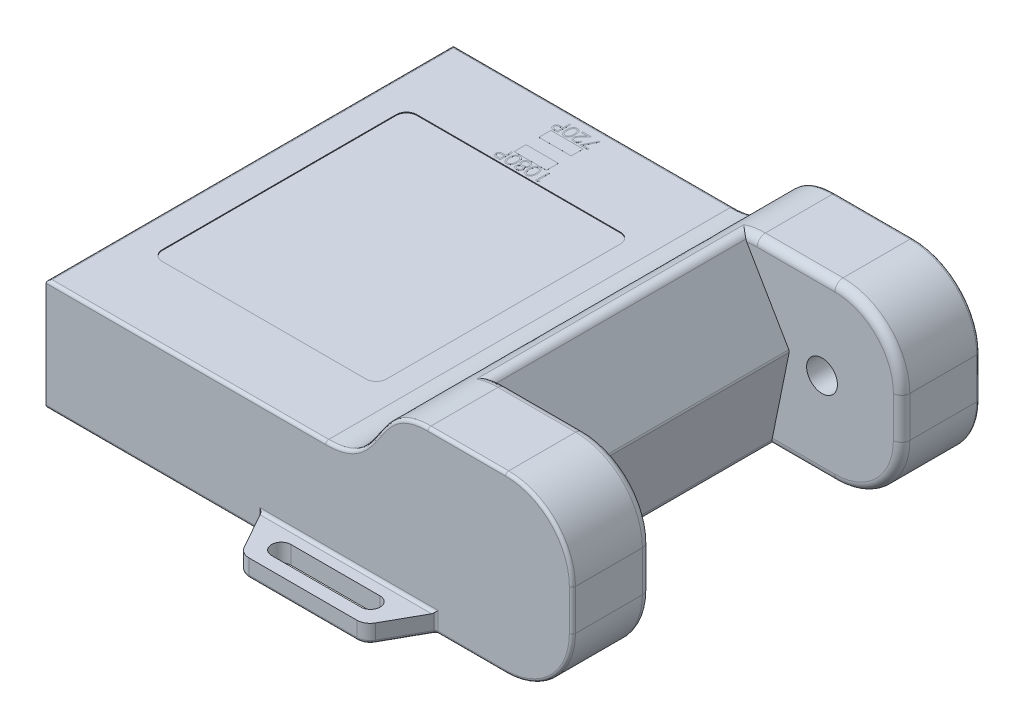
from build123d import *

# Parameters (mm, degrees)
SKETCH1_W               = 52.07
SKETCH1_H               = 40.2971
BOSS_EXTRUDE1_DEPTH     = 8.61568
CUT_EXTRUDE1_DEPTH      = 49.743280924
FILLET1_R               = 6.604
SKETCH3_W               = 11.43
SKETCH3_H               = 3.7338
CUT_EXTRUDE2_DEPTH      = 2.54
SKETCH4_W               = 3.059948917
SKETCH4_H               = 0.508
BOSS_EXTRUDE2_DEPTH     = 2.4892
SKETCH4_3_W             = 0.127
SKETCH4_3_H             = 0.508
BOSS_EXTRUDE3_DEPTH     = 1.0668
SKETCH6_R               = 0.127
BOSS_EXTRUDE4_DEPTH     = 1.524
FILLET2_R               = 0.254
FILLET3_R               = 0.127
SKETCH7_W               = 6.0452
SKETCH7_H               = 2.8702
BOSS_EXTRUDE5_DEPTH     = 0.8382
FILLET4_R               = 0.0508
SKETCH8_W               = 12.2174
SKETCH8_H               = 4.5466
BOSS_EXTRUDE6_DEPTH     = 1.778
FILLET5_R               = 1.3208
FILLET6_R               = 0.3048
CUT_EXTRUDE3_START      = -17.23136
SKETCH9_W               = 11.0998
SKETCH9_H               = 24.8285
CUT_EXTRUDE3_DEPTH      = 17.23136
CUT_EXTRUDE4_DEPTH      = 24.8285
FILLET7_R               = 0.8128
FILLET8_R               = 0.3048
FILLET9_R               = 0.3048
CUT_EXTRUDE5_DEPTH      = 14.95425
CUT_EXTRUDE5_DEPTH_BACK = 14.95425
SKETCH11_R              = 1.524
SKETCH12_W              = 3.2004
SKETCH12_H              = 1.1811
LEDS_DEPTH              = 0.00254
LEDS_2_DEPTH            = 0.00254
SKETCH13_W              = 22.1742
SKETCH13_H              = 25.1714
CUT_EXTRUDE6_DEPTH      = 0.0762
BOSS_EXTRUDE8_DEPTH     = 0.00254
FILLET10_R              = 1.016


with BuildPart() as part:
    # Sketch1 → Boss-Extrude1 (new, symmetric)
    with BuildSketch(Plane(origin=(0, 0, 0), x_dir=(1, 0, 0), z_dir=(0, 1, 0))):
        Rectangle(SKETCH1_W, SKETCH1_H)
    extrude(amount=BOSS_EXTRUDE1_DEPTH, both=True)

    # Sketch2 → Cut-Extrude1 (cut, through all)
    with BuildSketch(Plane.XY.offset(20.14855)):
        with BuildLine():
            Line((-26.035, 8.61568), (-26.035, 2.40792))
            Line((-26.035, 2.40792), (1.627580377, 2.40792))
            add(Edge.make_bspline(
                [(1.627580377, 2.40792), (7.588369881, 2.40792), (5.859828389, 8.61568), (11.7475, 8.61568)],
                knots=[0, 0, 0, 0, 1, 1, 1, 1], degree=3))
            Line((11.7475, 8.61568), (-26.035, 8.61568))
        make_face()
    extrude(amount=-CUT_EXTRUDE1_DEPTH, mode=Mode.SUBTRACT)

    # Fillet1
    fillet1_edges = [part.edges().sort_by_distance(p)[0] for p in [
        (26.035, 8.61568, 0),
        (26.035, -8.61568, 0),
    ]]
    fillet(fillet1_edges, radius=FILLET1_R)

    # Sketch3 → Cut-Extrude2 (cut)
    with BuildSketch(Plane.ZY.offset(26.035)):
        with Locations((12.73175, -1.66878)):
            Rectangle(SKETCH3_W, SKETCH3_H)
    extrude(amount=-CUT_EXTRUDE2_DEPTH, mode=Mode.SUBTRACT)

    # Sketch4 → Boss-Extrude2 (add)
    with BuildSketch(Plane.ZY.offset(23.495)):
        Polygon((17.93875, -0.05588), (7.52475, -0.05588), (7.52475, -3.28168), (9.544801083, -3.28168), (9.544801083, -2.77368), (8.03275, -2.77368), (8.03275, -0.56388), (17.43075, -0.56388), (17.43075, -2.77368), (15.918698917, -2.77368), (15.918698917, -3.28168), (17.93875, -3.28168), align=None)
        with Locations((11.201775542, -3.02768)):
            Rectangle(SKETCH4_W, SKETCH4_H)
        with Locations((14.261724459, -3.02768)):
            Rectangle(SKETCH4_W, SKETCH4_H)
    extrude(amount=BOSS_EXTRUDE2_DEPTH)

    # Sketch4<3> → Boss-Extrude3 (add)
    with BuildSketch(Plane.ZY.offset(23.495)):
        with Locations((15.855198917, -3.02768)):
            Rectangle(SKETCH4_3_W, SKETCH4_3_H)
        with Locations((9.608301083, -3.02768)):
            Rectangle(SKETCH4_3_W, SKETCH4_3_H)
    extrude(amount=BOSS_EXTRUDE3_DEPTH)

    # Sketch6 → Boss-Extrude4 (add)
    with BuildSketch(Plane.ZY.offset(23.495)):
        with Locations(Location((8.873947615, -1.960843183, 0), (0, 0, 180))):
            Circle(SKETCH6_R)
        with Locations(Location((10.143947615, -1.960843183, 0), (0, 0, 180))):
            Circle(SKETCH6_R)
        with Locations(Location((11.413947615, -1.960843183, 0), (0, 0, 180))):
            Circle(SKETCH6_R)
        with Locations(Location((12.683947615, -1.960843183, 0), (0, 0, 180))):
            Circle(SKETCH6_R)
        with Locations(Location((13.953947615, -1.960843183, 0), (0, 0, 180))):
            Circle(SKETCH6_R)
        with Locations(Location((15.223947615, -1.960843183, 0), (0, 0, 180))):
            Circle(SKETCH6_R)
        with Locations(Location((16.493947615, -1.960843183, 0), (0, 0, 180))):
            Circle(SKETCH6_R)
    extrude(amount=BOSS_EXTRUDE4_DEPTH)

    # Fillet2
    fillet2_edges = [part.edges().sort_by_distance(p)[0] for p in [
        (-24.7396, -3.28168, 7.52475),
        (-24.7396, -0.05588, 7.52475),
        (-24.7396, -0.05588, 17.93875),
        (-24.7396, -3.28168, 17.93875),
    ]]
    fillet(fillet2_edges, radius=FILLET2_R)

    # Fillet3
    fillet3_edges = [part.edges().sort_by_distance(p)[0] for p in [
        (-24.765, -3.53568, 7.01675),
        (-24.765, 0.19812, 7.01675),
        (-24.765, 0.19812, 18.44675),
        (-24.765, -3.53568, 18.44675),
    ]]
    fillet(fillet3_edges, radius=FILLET3_R)

    # Sketch8 → Boss-Extrude6 (add)
    # profile 1 of 3: a face of its own
    with BuildSketch(Plane.XZ.offset(8.61568)):
        Polygon((-2.1844, 20.14855), (-2.1844, 24.69515), (-4.7244, 20.14855), align=None)
    # profile 2 of 3: a face of its own
    with BuildSketch(Plane.XZ.offset(8.61568)):
        with Locations((3.9243, 22.42185)):
            Rectangle(SKETCH8_W, SKETCH8_H)
        with BuildLine():
            ThreePointArc((-0.48895, 21.46935), (-1.44145, 22.42185), (-0.48895, 23.37435))
            Line((-0.48895, 23.37435), (8.33755, 23.37435))
            ThreePointArc((8.33755, 23.37435), (9.29005, 22.42185), (8.33755, 21.46935))
            Line((8.33755, 21.46935), (-0.48895, 21.46935))
        make_face(mode=Mode.SUBTRACT)
    # profile 3 of 3: a face of its own
    with BuildSketch(Plane.XZ.offset(8.61568)):
        Polygon((12.573, 20.14855), (10.033, 24.69515), (10.033, 20.14855), align=None)
    boss_extrude6 = extrude(amount=-BOSS_EXTRUDE6_DEPTH)

    # Mirror1: Boss-Extrude6 across plane
    add(boss_extrude6.mirror(Plane.XY))

    # Fillet5
    fillet5_edges = [part.edges().sort_by_distance(p)[0] for p in [
        (-2.1844, -7.72668, 24.69515),
        (10.033, -7.72668, 24.69515),
        (10.033, -7.72668, -24.69515),
        (-2.1844, -7.72668, -24.69515),
    ]]
    fillet(fillet5_edges, radius=FILLET5_R)

    # Fillet6
    fillet6_edges = [part.edges().sort_by_distance(p)[0] for p in [
        (12.573, -7.72668, 20.14855),
        (-4.7244, -7.72668, 20.14855),
        (3.9243, -6.83768, 20.14855),
        (3.9243, -6.83768, -20.14855),
        (-4.7244, -7.72668, -20.14855),
        (12.573, -7.72668, -20.14855),
    ]]
    fillet(fillet6_edges, radius=FILLET6_R)

    # Sketch9 → Cut-Extrude3 (cut)
    with BuildSketch(Plane(origin=(0, 8.61568, 0), x_dir=(1, 0, 0), z_dir=(0, 1, 0)).offset(CUT_EXTRUDE3_START)):
        with Locations((20.4851, 0)):
            Rectangle(SKETCH9_W, SKETCH9_H)
    extrude(amount=CUT_EXTRUDE3_DEPTH, mode=Mode.SUBTRACT)

    # Sketch10 → Cut-Extrude4 (cut)
    with BuildSketch(Plane.XY.offset(-12.41425)):
        Polygon((10.287, 8.463876967), (14.9352, 0.48768), (14.9352, 8.463876967), (14.9352, 8.61568), (14.9352, 11.529790854), (10.287, 11.529790854), align=None)
        Polygon((14.9352, -8.61568), (14.9352, 0.48768), (13.081, -8.61568), (13.081, -10.46973801), (14.9352, -10.46973801), align=None)
    extrude(amount=CUT_EXTRUDE4_DEPTH, mode=Mode.SUBTRACT)

    # Fillet7
    fillet7_edges = [part.edges().sort_by_distance(p)[0] for p in [
        (26.035, 0, -12.41425),
        (16.256, -8.61568, 12.41425),
        (24.100733183, -6.681413183, 12.41425),
        (26.035, 0, 12.41425),
        (24.100733183, 6.681413183, 12.41425),
        (24.100733183, -6.681413183, -12.41425),
        (16.256, -8.61568, -12.41425),
        (24.100733183, 6.681413183, -12.41425),
        (15.58925, 8.61568, 12.41425),
        (15.58925, 8.61568, -12.41425),
        (11.01291256, 8.580648489, -12.41425),
        (11.01291256, 8.580648489, 12.41425),
        (10.287, 8.463876967, 0),
        (13.081, -8.61568, 0),
    ]]
    fillet(fillet7_edges, radius=FILLET7_R)

    # Fillet8
    fillet8_edges = [part.edges().sort_by_distance(p)[0] for p in [
        (14.9352, 0.48768, 0),
    ]]
    fillet(fillet8_edges, radius=FILLET8_R)

    # Fillet9
    fillet9_edges = [part.edges().sort_by_distance(p)[0] for p in [
        (15.58925, 8.61568, 20.14855),
        (-12.203709812, 2.40792, -20.14855),
        (-12.203709812, 2.40792, 20.14855),
        (6.701452199, 5.49181642, -20.14855),
        (6.701464032, 5.491833932, 20.14855),
        (-26.035, 2.40792, 0),
        (26.035, 0, -20.14855),
        (26.035, 0, 20.14855),
        (15.58925, 8.61568, -20.14855),
        (3.9243, -8.61568, -24.69515),
        (11.448386749, -8.61568, 22.161607719),
        (3.9243, -8.61568, 24.69515),
        (-15.46912987, -8.61568, -20.14855),
        (-3.599786749, -8.61568, 22.161607719),
        (-3.599786749, -8.61568, -22.161607719),
        (11.448386749, -8.61568, -22.161607719),
        (9.926406837, -8.61568, 24.513501541),
        (24.100733183, 6.681413183, -20.14855),
        (-2.077806837, -8.61568, 24.513501541),
        (-2.077806837, -8.61568, -24.513501541),
        (9.926406837, -8.61568, -24.513501541),
        (24.100733183, -6.681413183, -20.14855),
        (24.100733183, 6.681413183, 20.14855),
        (24.100733183, -6.681413183, 20.14855),
        (-15.46912987, -8.61568, 20.14855),
        (12.597598422, -8.61568, -20.190468875),
        (-4.748998422, -8.61568, -20.190468875),
        (12.597598422, -8.61568, 20.190468875),
        (-4.748998422, -8.61568, 20.190468875),
        (-26.035, -8.61568, 0),
    ]]
    fillet(fillet9_edges, radius=FILLET9_R)

    # Sketch11 → Cut-Extrude5 (cut, two sides: drawn at the far end of the back side and taken through both)
    with BuildSketch(Plane.XY.offset(-CUT_EXTRUDE5_DEPTH_BACK)):
        with Locations((18.161, 0)):
            Circle(SKETCH11_R)
    extrude(amount=CUT_EXTRUDE5_DEPTH + CUT_EXTRUDE5_DEPTH_BACK, mode=Mode.SUBTRACT)

    # Sketch13 → Cut-Extrude6 (cut)
    with BuildSketch(Plane(origin=(0, 2.40792, 0), x_dir=(1, 0, 0), z_dir=(0, 1, 0))):
        with Locations((-11.7729, -0.24765)):
            Rectangle(SKETCH13_W, SKETCH13_H)
    extrude(amount=-CUT_EXTRUDE6_DEPTH, mode=Mode.SUBTRACT)

    # Sketch14 → Boss-Extrude8 (add)
    # profile 1 of 9: a face of its own
    with BuildSketch(Plane(origin=(0, 2.40792, 0), x_dir=(1, 0, 0), z_dir=(0, 1, 0))):
        with BuildLine():
            Line((-13.851141026, 12.57935), (-14.100205529, 12.57935))
            add(Edge.make_bspline(
                [(-14.100205529, 12.57935), (-14.117336343, 12.579368831), (-14.150159745, 12.579404912), (-14.197227779, 12.580498834), (-14.239975882, 12.581959948), (-14.278311877, 12.583985378), (-14.312353719, 12.586378998), (-14.341947367, 12.589736166), (-14.367325435, 12.593241473), (-14.382531489, 12.596805241), (-14.389466346, 12.598430529)],
                knots=[0, 0, 0, 0, 1.415646017, 2.712440637, 3.8905458, 4.950247383, 5.884950622, 6.709939814, 7.411656543, 8, 8, 8, 8], degree=3))
            add(Edge.make_bspline(
                [(-14.389466346, 12.598430529), (-14.398245087, 12.600833423), (-14.415595708, 12.605582591), (-14.440597751, 12.615093378), (-14.464381436, 12.626375658), (-14.487046249, 12.639215092), (-14.508203916, 12.654218018), (-14.528515019, 12.670518518), (-14.547553606, 12.688775824), (-14.565032199, 12.708965897), (-14.581226871, 12.73042732), (-14.594782972, 12.753707347), (-14.606753543, 12.777998384), (-14.616082317, 12.803893504), (-14.623415093, 12.831050895), (-14.628755561, 12.85954124), (-14.632187994, 12.889303078), (-14.632513689, 12.909645501), (-14.632679487, 12.920001042)],
                knots=[0, 0, 0, 0, 0.999333726, 1.975119402, 2.933498163, 3.889020618, 4.832249799, 5.779334906, 6.747801194, 7.724875447, 8.710438469, 9.696133548, 10.679360639, 11.681339199, 12.714023775, 13.766351759, 14.862936069, 16, 16, 16, 16], degree=3))
            add(Edge.make_bspline(
                [(-14.632679487, 12.920001042), (-14.63252657, 12.930443264), (-14.632227378, 12.950874176), (-14.62863644, 12.98076373), (-14.623799485, 13.009327261), (-14.616361983, 13.036501433), (-14.606620839, 13.062124869), (-14.595193722, 13.086589145), (-14.581411127, 13.109478054), (-14.565574289, 13.130874694), (-14.547956996, 13.150799148), (-14.528633787, 13.169107031), (-14.507682672, 13.185691176), (-14.485170236, 13.200588764), (-14.460877005, 13.213454328), (-14.435171423, 13.224977693), (-14.407830059, 13.234655478), (-14.388909776, 13.239746386), (-14.379290064, 13.242334776)],
                knots=[0, 0, 0, 0, 1.121902311, 2.195077645, 3.232258892, 4.234102512, 5.217864754, 6.176164875, 7.132989551, 8.084763148, 9.034132444, 9.988522005, 10.94243251, 11.903244335, 12.886203696, 13.894208494, 14.929344452, 16, 16, 16, 16], degree=3))
            add(Edge.make_bspline(
                [(-14.379290064, 13.242334776), (-14.371333484, 13.244025511), (-14.353896175, 13.247730855), (-14.325180474, 13.251895558), (-14.291729899, 13.255311069), (-14.253658266, 13.258498452), (-14.210876791, 13.260187366), (-14.163483594, 13.262170427), (-14.111318282, 13.263106125), (-14.074934603, 13.263165273), (-14.055938702, 13.263196154)],
                knots=[0, 0, 0, 0, 0.601372724, 1.317943291, 2.144091499, 3.08771165, 4.142394186, 5.309582461, 6.595334295, 8, 8, 8, 8], degree=3))
            Line((-14.055938702, 13.263196154), (-13.965115385, 13.263196154))
            Line((-13.965115385, 13.263196154), (-13.965115385, 13.84935))
            Line((-13.965115385, 13.84935), (-13.851141026, 13.84935))
            Line((-13.851141026, 13.84935), (-13.851141026, 12.57935))
        make_face()
        with BuildLine():
            Line((-13.965115385, 12.70960641), (-13.965115385, 13.132939744))
            Line((-13.965115385, 13.132939744), (-14.187467147, 13.135738221))
            add(Edge.make_bspline(
                [(-14.187467147, 13.135738221), (-14.198323989, 13.13574538), (-14.219282898, 13.1357592), (-14.249640433, 13.134288336), (-14.277737416, 13.132688202), (-14.303615331, 13.130100406), (-14.327156064, 13.126944102), (-14.348416611, 13.122724107), (-14.36756664, 13.118419985), (-14.389625353, 13.110951569), (-14.414333425, 13.099684516), (-14.441150433, 13.082855767), (-14.464063367, 13.061655776), (-14.483723765, 13.037561765), (-14.499263967, 13.010729959), (-14.510526625, 12.982101197), (-14.517401117, 12.951784187), (-14.518265183, 12.931061146), (-14.518705128, 12.920509856)],
                knots=[0, 0, 0, 0, 1.160501667, 2.240324542, 3.248665471, 4.168823117, 5.020172044, 5.786515869, 6.485785279, 7.116517804, 8.272762037, 9.381837012, 10.485674779, 11.594342068, 12.695271952, 13.786226926, 14.872841088, 16, 16, 16, 16], degree=3))
            add(Edge.make_bspline(
                [(-14.518705128, 12.920509856), (-14.518245555, 12.910300399), (-14.517331981, 12.890005261), (-14.510583411, 12.860246829), (-14.499144692, 12.831943531), (-14.483711096, 12.805324392), (-14.46452183, 12.78129442), (-14.442064587, 12.760566899), (-14.416688766, 12.743790397), (-14.393267938, 12.73262244), (-14.372308141, 12.726073301), (-14.354190303, 12.721345154), (-14.333629329, 12.718084252), (-14.310819801, 12.714964182), (-14.285790924, 12.712445607), (-14.258383546, 12.710696627), (-14.228688957, 12.709683778), (-14.208074932, 12.709632824), (-14.197389022, 12.70960641)],
                knots=[0, 0, 0, 0, 1.12039168, 2.227199994, 3.330242575, 4.460839274, 5.593542475, 6.693949254, 7.801736126, 8.92216649, 9.528704869, 10.210659466, 10.975987387, 11.81211542, 12.738540127, 13.736887663, 14.826846554, 16, 16, 16, 16], degree=3))
            Line((-14.197389022, 12.70960641), (-13.965115385, 12.70960641))
        make_face(mode=Mode.SUBTRACT)
    # profile 2 of 9: a face of its own
    with BuildSketch(Plane(origin=(0, 2.40792, 0), x_dir=(1, 0, 0), z_dir=(0, 1, 0))):
        with BuildLine():
            add(Edge.make_bspline(
                [(-12.76024359, 13.214858814), (-12.760362613, 13.194503476), (-12.760593819, 13.154962939), (-12.763165903, 13.097346798), (-12.76743867, 13.043295492), (-12.773294232, 12.992806438), (-12.780420009, 12.945866594), (-12.789932499, 12.902601423), (-12.800750243, 12.86281061), (-12.813287994, 12.826364636), (-12.827434479, 12.792771669), (-12.842833862, 12.761413382), (-12.860086675, 12.732327232), (-12.878244078, 12.705084673), (-12.897941546, 12.679959863), (-12.91911058, 12.65706572), (-12.941564723, 12.636047464), (-12.965410221, 12.617250713), (-12.990419797, 12.600871852), (-13.015853634, 12.586024785), (-13.042437158, 12.574280345), (-13.069514672, 12.564237496), (-13.097304333, 12.556282203), (-13.125818247, 12.550748672), (-13.155082002, 12.547286778), (-13.174832501, 12.546954442), (-13.184848958, 12.546785897)],
                knots=[0, 0, 0, 0, 1.64625301, 3.197870201, 4.6634513, 6.030635694, 7.308242971, 8.501545196, 9.611429483, 10.641742253, 11.616230371, 12.55791849, 13.464870342, 14.34944951, 15.20427819, 16.044004467, 16.869007726, 17.689551165, 18.496129964, 19.285613293, 20.0683943, 20.843080271, 21.620342827, 22.403213977, 23.190190624, 24, 24, 24, 24], degree=3))
            add(Edge.make_bspline(
                [(-13.184848958, 12.546785897), (-13.194954159, 12.546926051), (-13.215059951, 12.547204907), (-13.244678219, 12.551129976), (-13.273780588, 12.556196176), (-13.301925516, 12.564321526), (-13.329645171, 12.574044562), (-13.356250219, 12.586873953), (-13.382679961, 12.600826911), (-13.407733729, 12.617848348), (-13.432160082, 12.636659835), (-13.455057238, 12.658015684), (-13.477010509, 12.681324866), (-13.497190729, 12.707107246), (-13.516462793, 12.734967504), (-13.534095116, 12.765139188), (-13.550454416, 12.797555434), (-13.565848206, 12.832065964), (-13.579309668, 12.869592609), (-13.591277985, 12.909901306), (-13.601088045, 12.953357068), (-13.609200792, 12.99971782), (-13.615497829, 13.049213232), (-13.620080705, 13.10174302), (-13.622502357, 13.157340049), (-13.622958321, 13.195352195), (-13.623192308, 13.214858814)],
                knots=[0, 0, 0, 0, 0.810910589, 1.61342667, 2.396193133, 3.181089899, 3.963115317, 4.752255436, 5.550715454, 6.36105385, 7.181178335, 8.024612154, 8.872680183, 9.750181803, 10.651284446, 11.591556747, 12.554036451, 13.566402641, 14.62422919, 15.753422176, 16.94128843, 18.199818041, 19.531985927, 20.947085226, 22.433341622, 24, 24, 24, 24], degree=3))
            add(Edge.make_bspline(
                [(-13.623192308, 13.214858814), (-13.622952882, 13.234280104), (-13.622485327, 13.272206402), (-13.620135819, 13.32755688), (-13.615374977, 13.379800027), (-13.609572372, 13.429011533), (-13.60120615, 13.475127072), (-13.591892046, 13.5183943), (-13.580011382, 13.558406671), (-13.566869223, 13.595611647), (-13.551689627, 13.629975988), (-13.535453532, 13.66225843), (-13.517557999, 13.692258883), (-13.49865573, 13.720295733), (-13.478093458, 13.745856997), (-13.456437281, 13.769426921), (-13.433317987, 13.790819872), (-13.408765893, 13.809853473), (-13.383475322, 13.82700313), (-13.357040428, 13.841453609), (-13.330080026, 13.854051478), (-13.302313694, 13.864178691), (-13.273918488, 13.872184293), (-13.244792155, 13.877634065), (-13.21505599, 13.881475468), (-13.194952834, 13.881767385), (-13.184848958, 13.881914103)],
                knots=[0, 0, 0, 0, 1.561431216, 3.049195289, 4.452146966, 5.778046447, 7.031138842, 8.218704273, 9.334037798, 10.384210803, 11.388620812, 12.352076869, 13.287433199, 14.19507451, 15.06813243, 15.922055533, 16.766344942, 17.596869952, 18.417486629, 19.220035357, 20.016159057, 20.807716045, 21.59340902, 22.384936649, 23.188266813, 24, 24, 24, 24], degree=3))
            add(Edge.make_bspline(
                [(-13.184848958, 13.881914103), (-13.17483285, 13.881744065), (-13.155083039, 13.881408783), (-13.125814242, 13.877968464), (-13.097341672, 13.872358463), (-13.069608407, 13.86474011), (-13.042557699, 13.855057631), (-13.016454509, 13.842741892), (-12.990954203, 13.828457495), (-12.966172765, 13.812206527), (-12.942583941, 13.793582552), (-12.920047116, 13.772987974), (-12.899152175, 13.74989205), (-12.879590548, 13.724663408), (-12.861282488, 13.697352269), (-12.844102736, 13.66804345), (-12.828750249, 13.636379679), (-12.814283009, 13.60260435), (-12.801530027, 13.565890581), (-12.790394358, 13.52596341), (-12.781005976, 13.482550497), (-12.773527999, 13.435649764), (-12.767401868, 13.385333817), (-12.763170115, 13.331522473), (-12.760595105, 13.274330993), (-12.7603629, 13.235044629), (-12.76024359, 13.214858814)],
                knots=[0, 0, 0, 0, 0.810976328, 1.599087026, 2.383086309, 3.159618043, 3.926613167, 4.707144544, 5.494386734, 6.292609454, 7.104690378, 7.92621526, 8.762510248, 9.62398222, 10.509836085, 11.424023232, 12.373226806, 13.358118208, 14.398657954, 15.5185989, 16.713620699, 17.994156382, 19.364120462, 20.818119981, 22.365111093, 24, 24, 24, 24], degree=3))
        make_face()
        with BuildLine():
            add(Edge.make_bspline(
                [(-12.874217949, 13.21435), (-12.874262241, 13.231313031), (-12.874348205, 13.264234945), (-12.876528943, 13.311991598), (-12.879564307, 13.356609069), (-12.883382971, 13.398069942), (-12.88910196, 13.436229318), (-12.895590517, 13.471245822), (-12.903373094, 13.503054696), (-12.912626851, 13.531933725), (-12.923167225, 13.558292477), (-12.934657166, 13.582831329), (-12.947103256, 13.605848759), (-12.960791045, 13.627261721), (-12.97591664, 13.646950619), (-12.992142432, 13.66500896), (-13.009562768, 13.681363218), (-13.03367248, 13.700772408), (-13.065346955, 13.721065415), (-13.105459511, 13.73851933), (-13.146695138, 13.749558899), (-13.174691308, 13.750958906), (-13.188665064, 13.751657692)],
                knots=[0, 0, 0, 0, 1.459193451, 2.832007961, 4.111736495, 5.306635028, 6.412683014, 7.430020708, 8.369596877, 9.227877302, 10.036669781, 10.810175692, 11.557788084, 12.286326232, 12.994037279, 13.69140682, 14.37267704, 15.047194847, 16.352618509, 17.594157723, 18.799169539, 20, 20, 20, 20], degree=3))
            add(Edge.make_bspline(
                [(-13.188665064, 13.751657692), (-13.20271906, 13.751044952), (-13.230777199, 13.749821645), (-13.271984759, 13.739145106), (-13.311658284, 13.721788444), (-13.34296821, 13.701958868), (-13.366722144, 13.682953611), (-13.383747726, 13.666768484), (-13.399372704, 13.648640636), (-13.414192652, 13.629083171), (-13.427784915, 13.607720791), (-13.440144976, 13.584656679), (-13.451423788, 13.559826657), (-13.457849643, 13.542493067), (-13.461135016, 13.533630849)],
                knots=[0, 0, 0, 0, 1.353621445, 2.702441307, 4.075953605, 5.516772412, 6.261413105, 7.007624062, 7.778524365, 8.566925914, 9.372323995, 10.217594641, 11.088702136, 12, 12, 12, 12], degree=3))
            add(Edge.make_bspline(
                [(-13.461135016, 13.533630849), (-13.4649638, 13.522298915), (-13.472737875, 13.499290229), (-13.482757004, 13.463598276), (-13.490647477, 13.426150416), (-13.497746184, 13.387170445), (-13.502591436, 13.346370896), (-13.506491357, 13.303878008), (-13.508788492, 13.259659742), (-13.509073244, 13.229616989), (-13.509217949, 13.21435)],
                knots=[0, 0, 0, 0, 0.884706709, 1.796334032, 2.740027952, 3.714592787, 4.726048262, 5.777819803, 6.87074269, 8, 8, 8, 8], degree=3))
            add(Edge.make_bspline(
                [(-13.509217949, 13.21435), (-13.509058355, 13.19908334), (-13.508746118, 13.169214794), (-13.506694692, 13.125517085), (-13.503398219, 13.083941152), (-13.498936516, 13.04444928), (-13.492811543, 13.007111758), (-13.485456055, 12.971875161), (-13.476832603, 12.938748972), (-13.466941201, 12.907647821), (-13.455793887, 12.878683287), (-13.443478898, 12.851793021), (-13.430339033, 12.826831991), (-13.41605784, 12.803880481), (-13.400837372, 12.782804569), (-13.384131117, 12.764089409), (-13.367000243, 12.746824561), (-13.342636514, 12.727469394), (-13.310999476, 12.707578764), (-13.271360759, 12.689772135), (-13.230336396, 12.679233691), (-13.202545493, 12.677772242), (-13.188665064, 12.677042308)],
                knots=[0, 0, 0, 0, 1.313528337, 2.569860077, 3.762944266, 4.901481389, 5.988248151, 7.017139294, 7.997571128, 8.932104357, 9.823695246, 10.66607014, 11.475539426, 12.248954257, 12.990316782, 13.708962568, 14.405488541, 15.08007697, 16.381737273, 17.610043218, 18.806313575, 20, 20, 20, 20], degree=3))
            add(Edge.make_bspline(
                [(-13.188665064, 12.677042308), (-13.174615925, 12.677773106), (-13.146492052, 12.679236033), (-13.105038528, 12.689734953), (-13.065162516, 12.707452118), (-13.033592147, 12.72749399), (-13.00957141, 12.746749394), (-12.992477825, 12.763183473), (-12.976345941, 12.781072932), (-12.961292807, 12.800672559), (-12.947688531, 12.822044691), (-12.93509117, 12.844895258), (-12.923692898, 12.869397658), (-12.913112739, 12.895741841), (-12.90395717, 12.924668324), (-12.895725245, 12.956470854), (-12.889371438, 12.991715086), (-12.883729816, 13.030053659), (-12.879465391, 13.071563826), (-12.876550097, 13.116286917), (-12.874341581, 13.164210047), (-12.874259985, 13.197301937), (-12.874217949, 13.21435)],
                knots=[0, 0, 0, 0, 1.207779899, 2.417760083, 3.652287919, 4.947299644, 5.621638849, 6.297435916, 6.984320042, 7.691843698, 8.42018894, 9.161205785, 9.934506883, 10.743085206, 11.601138371, 12.542248028, 13.566483018, 14.679455109, 15.87477181, 17.154161492, 18.533899613, 20, 20, 20, 20], degree=3))
        make_face(mode=Mode.SUBTRACT)
    # profile 3 of 9: a face of its own
    with BuildSketch(Plane(origin=(0, 2.40792, 0), x_dir=(1, 0, 0), z_dir=(0, 1, 0))):
        with BuildLine():
            add(Edge.make_bspline(
                [(-12.400766426, 13.14184399), (-12.411079011, 13.147263354), (-12.431254909, 13.157865986), (-12.459996239, 13.174989566), (-12.486821709, 13.192412211), (-12.511235164, 13.210760334), (-12.533475955, 13.229643918), (-12.553612524, 13.249012995), (-12.571861428, 13.268806309), (-12.587595737, 13.289532709), (-12.601556115, 13.310823619), (-12.613382268, 13.332941443), (-12.623703497, 13.355566575), (-12.631804375, 13.379042512), (-12.638492578, 13.403047196), (-12.643091003, 13.427902731), (-12.645564842, 13.453442043), (-12.64603246, 13.470702561), (-12.646269231, 13.479442147)],
                knots=[0, 0, 0, 0, 1.264219729, 2.473363326, 3.62979159, 4.734286947, 5.785533755, 6.79450939, 7.765315851, 8.704182021, 9.615576613, 10.525715488, 11.423813905, 12.311666436, 13.218214638, 14.126256791, 15.051260205, 16, 16, 16, 16], degree=3))
            add(Edge.make_bspline(
                [(-12.646269231, 13.479442147), (-12.645990884, 13.491670137), (-12.645439932, 13.515873917), (-12.640591128, 13.551588132), (-12.633428803, 13.586414341), (-12.622548545, 13.619957748), (-12.60915987, 13.652504152), (-12.592265133, 13.683615062), (-12.573197236, 13.714183532), (-12.557862638, 13.732985356), (-12.550103365, 13.742499038)],
                knots=[0, 0, 0, 0, 1.02531512, 2.029483338, 3.018748588, 4.004195107, 4.983200899, 5.966616707, 6.971112471, 8, 8, 8, 8], degree=3))
            add(Edge.make_bspline(
                [(-12.550103365, 13.742499038), (-12.540002702, 13.753600208), (-12.519926191, 13.775665367), (-12.485533529, 13.804313232), (-12.447788446, 13.828388584), (-12.406836993, 13.848008957), (-12.36278864, 13.863280111), (-12.315652769, 13.874253825), (-12.265337491, 13.880539392), (-12.23075522, 13.881447983), (-12.213014022, 13.881914103)],
                knots=[0, 0, 0, 0, 0.954267603, 1.896743057, 2.838368354, 3.796610408, 4.779680527, 5.799409237, 6.871065594, 8, 8, 8, 8], degree=3))
            add(Edge.make_bspline(
                [(-12.213014022, 13.881914103), (-12.195955271, 13.881494795), (-12.162760675, 13.880678866), (-12.114437979, 13.875180909), (-12.06933895, 13.865447422), (-12.027249764, 13.852400635), (-11.98857741, 13.835002435), (-11.953251575, 13.813677321), (-11.920754492, 13.788906743), (-11.892105638, 13.760094571), (-11.8666782, 13.729227944), (-11.844322492, 13.697393635), (-11.825845571, 13.664614811), (-11.809919948, 13.631390075), (-11.798068195, 13.597046221), (-11.789662148, 13.561935696), (-11.784381978, 13.526158246), (-11.783675782, 13.502017451), (-11.783320513, 13.489872837)],
                knots=[0, 0, 0, 0, 1.256864279, 2.445730223, 3.576845088, 4.651810441, 5.686528262, 6.692706664, 7.686234615, 8.689148594, 9.678739427, 10.630299996, 11.55097961, 12.448208961, 13.341360817, 14.221834469, 15.105450545, 16, 16, 16, 16], degree=3))
            add(Edge.make_bspline(
                [(-11.783320513, 13.489872837), (-11.783530252, 13.480961378), (-11.783944772, 13.463349192), (-11.78681236, 13.43732866), (-11.791426467, 13.412003708), (-11.797679007, 13.387274377), (-11.806230447, 13.363271151), (-11.816375505, 13.339870241), (-11.828318673, 13.317072326), (-11.842530241, 13.295224497), (-11.858187704, 13.273552853), (-11.876774554, 13.253133489), (-11.897051614, 13.232767001), (-11.920225987, 13.213691873), (-11.945046084, 13.194332232), (-11.972669457, 13.176306201), (-12.00217503, 13.158206936), (-12.023151139, 13.14739189), (-12.033911458, 13.14184399)],
                knots=[0, 0, 0, 0, 0.941575622, 1.860885767, 2.762557628, 3.660168386, 4.552890429, 5.45184204, 6.353736508, 7.268493418, 8.204037487, 9.175167802, 10.182660057, 11.238220596, 12.344046335, 13.507168087, 14.721227736, 16, 16, 16, 16], degree=3))
            add(Edge.make_bspline(
                [(-12.033911458, 13.14184399), (-12.019200519, 13.133788902), (-11.990760566, 13.118216386), (-11.952743231, 13.089962242), (-11.920539334, 13.058806789), (-11.894491115, 13.024703144), (-11.873924728, 12.988772174), (-11.859384057, 12.951203036), (-11.84989303, 12.912414752), (-11.84893158, 12.885964993), (-11.848448718, 12.87268133)],
                knots=[0, 0, 0, 0, 1.16701039, 2.256125286, 3.287752239, 4.277689688, 5.235169525, 6.160862735, 7.076343936, 8, 8, 8, 8], degree=3))
            add(Edge.make_bspline(
                [(-11.848448718, 12.87268133), (-11.849043196, 12.859148269), (-11.8502382, 12.831944457), (-11.859867941, 12.791437762), (-11.875679467, 12.751631892), (-11.896817123, 12.712619092), (-11.923717404, 12.676177021), (-11.955557645, 12.643228142), (-11.992297794, 12.614625208), (-12.033130316, 12.590446327), (-12.076993311, 12.570673335), (-12.123350735, 12.55717461), (-12.171376385, 12.548296487), (-12.204069597, 12.547294129), (-12.220646234, 12.546785897)],
                knots=[0, 0, 0, 0, 0.888724595, 1.786491426, 2.720083884, 3.697804067, 4.69440576, 5.687697823, 6.7000873, 7.744853364, 8.800284131, 9.853047784, 10.91141782, 12, 12, 12, 12], degree=3))
            add(Edge.make_bspline(
                [(-12.220646234, 12.546785897), (-12.236795364, 12.547308446), (-12.268639608, 12.548338852), (-12.31551728, 12.557017596), (-12.360408809, 12.571350011), (-12.403062597, 12.590870812), (-12.442571062, 12.615194302), (-12.477729939, 12.644112008), (-12.508826248, 12.67670187), (-12.534517412, 12.713264135), (-12.555127153, 12.752274334), (-12.56996854, 12.792740789), (-12.579351386, 12.834178369), (-12.580543666, 12.86220237), (-12.581141026, 12.876243029)],
                knots=[0, 0, 0, 0, 1.072634126, 2.115112298, 3.156050586, 4.19761425, 5.225177188, 6.230426315, 7.215180151, 8.209739481, 9.190420596, 10.139012357, 11.067603024, 12, 12, 12, 12], degree=3))
            add(Edge.make_bspline(
                [(-12.581141026, 12.876243029), (-12.580617336, 12.890021923), (-12.57958884, 12.917082888), (-12.571050893, 12.956474665), (-12.556448353, 12.993289484), (-12.536749481, 13.028093845), (-12.510894262, 13.060331577), (-12.479404738, 13.090162782), (-12.442689521, 13.118170898), (-12.415053162, 13.13377657), (-12.400766426, 13.14184399)],
                knots=[0, 0, 0, 0, 0.975463758, 1.915755378, 2.838359076, 3.772025586, 4.738400888, 5.753889765, 6.838863581, 8, 8, 8, 8], degree=3))
        make_face()
        with BuildLine():
            add(Edge.make_bspline(
                [(-12.214286058, 12.677042308), (-12.205377311, 12.677277922), (-12.187947907, 12.677738888), (-12.162396722, 12.68016574), (-12.13807963, 12.684827343), (-12.114863657, 12.691213676), (-12.092669275, 12.699159553), (-12.072005438, 12.709628518), (-12.052177726, 12.721264816), (-12.033836603, 12.734913663), (-12.017233231, 12.749804851), (-12.002403492, 12.765356351), (-11.990321857, 12.782026615), (-11.979927584, 12.798981651), (-11.972208384, 12.816924712), (-11.966724931, 12.83546293), (-11.962844248, 12.854713723), (-11.962564558, 12.867828198), (-11.962423077, 12.874462179)],
                knots=[0, 0, 0, 0, 1.20353747, 2.354645537, 3.462130888, 4.543058862, 5.604822423, 6.639552563, 7.666902586, 8.706944258, 9.720926464, 10.677177239, 11.602682187, 12.496457588, 13.358248655, 14.231532794, 15.105417644, 16, 16, 16, 16], degree=3))
            add(Edge.make_bspline(
                [(-11.962423077, 12.874462179), (-11.962681106, 12.881092404), (-11.963191009, 12.894194681), (-11.966881705, 12.913620635), (-11.973052578, 12.932461939), (-11.981514173, 12.950894481), (-11.992373045, 12.968870949), (-12.005552473, 12.986460227), (-12.02162431, 13.00319718), (-12.039372467, 13.019556669), (-12.058759188, 13.034628909), (-12.079131106, 13.048092258), (-12.100636895, 13.058825121), (-12.122632508, 13.068235649), (-12.145583099, 13.075294636), (-12.169330422, 13.08038022), (-12.193849111, 13.083525971), (-12.21046064, 13.083902886), (-12.218865385, 13.08409359)],
                knots=[0, 0, 0, 0, 0.873213166, 1.72559466, 2.594724523, 3.479581045, 4.391597569, 5.35687048, 6.368548091, 7.443976143, 8.534559525, 9.600545123, 10.654815915, 11.696401765, 12.749428718, 13.812189468, 14.893058657, 16, 16, 16, 16], degree=3))
            add(Edge.make_bspline(
                [(-12.218865385, 13.08409359), (-12.229661069, 13.083778461), (-12.251145808, 13.083151316), (-12.28280618, 13.077267128), (-12.313667727, 13.068128429), (-12.343146498, 13.055157698), (-12.37071489, 13.039343259), (-12.395595362, 13.020693611), (-12.416746713, 12.998770779), (-12.43474113, 12.974846454), (-12.448810216, 12.949468526), (-12.459587357, 12.92389692), (-12.465934141, 12.897921003), (-12.466759171, 12.880515143), (-12.467166667, 12.871918109)],
                knots=[0, 0, 0, 0, 1.076561449, 2.142489767, 3.202892658, 4.283174188, 5.348766409, 6.369549039, 7.375093932, 8.378927502, 9.349008457, 10.26378795, 11.142457041, 12, 12, 12, 12], degree=3))
            add(Edge.make_bspline(
                [(-12.467166667, 12.871918109), (-12.466977234, 12.865883242), (-12.466601236, 12.853904896), (-12.463377284, 12.836158189), (-12.458348902, 12.818804148), (-12.451019326, 12.801944651), (-12.44215282, 12.785188036), (-12.430850905, 12.769059973), (-12.41775263, 12.753072383), (-12.402668903, 12.737751505), (-12.385627403, 12.723367853), (-12.366490277, 12.71089948), (-12.345426404, 12.700502244), (-12.322718178, 12.691767282), (-12.298125622, 12.685279751), (-12.271860473, 12.680397649), (-12.243685738, 12.677651586), (-12.224298499, 12.677249805), (-12.214286058, 12.677042308)],
                knots=[0, 0, 0, 0, 0.814035228, 1.61574325, 2.427118093, 3.24780647, 4.092880925, 4.981933388, 5.900917883, 6.880367106, 7.87994501, 8.905470125, 9.95492938, 11.0455354, 12.184050453, 13.382997595, 14.64846247, 16, 16, 16, 16], degree=3))
        make_face(mode=Mode.SUBTRACT)
        with BuildLine():
            add(Edge.make_bspline(
                [(-12.221663862, 13.21435), (-12.21036968, 13.21455095), (-12.188213249, 13.214945165), (-12.155752725, 13.219331114), (-12.124601887, 13.225440737), (-12.094856362, 13.234694084), (-12.066668839, 13.246733946), (-12.039642628, 13.261011161), (-12.014200954, 13.278123812), (-11.990457532, 13.297656939), (-11.968719791, 13.318824518), (-11.949579407, 13.34118031), (-11.933408496, 13.36442075), (-11.92028562, 13.388575233), (-11.910105241, 13.413590541), (-11.902591963, 13.439481271), (-11.898229764, 13.466319642), (-11.89760824, 13.484514975), (-11.897294872, 13.493688942)],
                knots=[0, 0, 0, 0, 1.140332253, 2.237053636, 3.304055028, 4.344690294, 5.377465719, 6.397042765, 7.428360044, 8.469453732, 9.499453352, 10.490108612, 11.438398528, 12.354680514, 13.261581007, 14.161901135, 15.073242693, 16, 16, 16, 16], degree=3))
            add(Edge.make_bspline(
                [(-11.897294872, 13.493688942), (-11.897798681, 13.505091879), (-11.898801886, 13.527797847), (-11.906475219, 13.561270476), (-11.91907705, 13.593666037), (-11.936755933, 13.624527639), (-11.958320037, 13.6534811), (-11.984535412, 13.679074129), (-12.014762899, 13.700962204), (-12.048754166, 13.719256145), (-12.086015249, 13.733745194), (-12.126315883, 13.744111119), (-12.169383084, 13.750626541), (-12.199082525, 13.751308559), (-12.214286058, 13.751657692)],
                knots=[0, 0, 0, 0, 0.899105568, 1.790333855, 2.694925079, 3.632758987, 4.588257081, 5.534574046, 6.511571685, 7.523527334, 8.572244311, 9.657983075, 10.801090915, 12, 12, 12, 12], degree=3))
            add(Edge.make_bspline(
                [(-12.214286058, 13.751657692), (-12.226168939, 13.75142686), (-12.249320602, 13.750977125), (-12.283108912, 13.747089981), (-12.314919768, 13.740740424), (-12.345057928, 13.732131104), (-12.373299067, 13.720718697), (-12.399604691, 13.706543392), (-12.42433301, 13.690352131), (-12.446427185, 13.671183078), (-12.466516222, 13.650671005), (-12.484112635, 13.629071115), (-12.499004612, 13.606599731), (-12.511008976, 13.583270008), (-12.520541587, 13.55916768), (-12.527413515, 13.534193808), (-12.531648878, 13.508250295), (-12.53207757, 13.490652191), (-12.532294872, 13.481731811)],
                knots=[0, 0, 0, 0, 1.224631902, 2.385975653, 3.500340538, 4.565441647, 5.612488581, 6.63322211, 7.641830068, 8.652595074, 9.641693811, 10.598750962, 11.520088299, 12.415429315, 13.298523938, 14.187139574, 15.081071174, 16, 16, 16, 16], degree=3))
            add(Edge.make_bspline(
                [(-12.532294872, 13.481731811), (-12.53196835, 13.473066761), (-12.531324505, 13.455980796), (-12.527179411, 13.430679821), (-12.520063655, 13.406135733), (-12.509687682, 13.38245923), (-12.496945461, 13.359374893), (-12.481204752, 13.33707652), (-12.462657402, 13.315502366), (-12.44134881, 13.29509662), (-12.418255109, 13.276232434), (-12.393780828, 13.259468243), (-12.36781443, 13.245766716), (-12.340870299, 13.234256469), (-12.312676815, 13.22528646), (-12.283369964, 13.218996571), (-12.252894226, 13.215043381), (-12.232191592, 13.214583738), (-12.221663862, 13.21435)],
                knots=[0, 0, 0, 0, 0.917336384, 1.808827106, 2.706624561, 3.615530867, 4.539869921, 5.493819324, 6.499753197, 7.547410123, 8.613069608, 9.653934021, 10.682176708, 11.716048074, 12.752411263, 13.808993382, 14.885826486, 16, 16, 16, 16], degree=3))
        make_face(mode=Mode.SUBTRACT)
    # profile 4 of 9: a face of its own
    with BuildSketch(Plane(origin=(0, 2.40792, 0), x_dir=(1, 0, 0), z_dir=(0, 1, 0))):
        with BuildLine():
            add(Edge.make_bspline(
                [(-10.806397436, 13.214858814), (-10.80651646, 13.194503476), (-10.806747665, 13.154962939), (-10.809319749, 13.097346798), (-10.813592516, 13.043295492), (-10.819448078, 12.992806438), (-10.826573856, 12.945866594), (-10.836086345, 12.902601423), (-10.846904089, 12.86281061), (-10.85944184, 12.826364636), (-10.873588325, 12.792771669), (-10.888987708, 12.761413382), (-10.906240521, 12.732327232), (-10.924397924, 12.705084673), (-10.944095392, 12.679959863), (-10.965264427, 12.65706572), (-10.987718569, 12.636047464), (-11.011564067, 12.617250713), (-11.036573643, 12.600871852), (-11.06200748, 12.586024785), (-11.088591004, 12.574280345), (-11.115668518, 12.564237496), (-11.143458179, 12.556282203), (-11.171972093, 12.550748672), (-11.201235848, 12.547286778), (-11.220986347, 12.546954442), (-11.231002804, 12.546785897)],
                knots=[0, 0, 0, 0, 1.64625301, 3.197870201, 4.6634513, 6.030635694, 7.308242971, 8.501545196, 9.611429483, 10.641742253, 11.616230371, 12.55791849, 13.464870342, 14.34944951, 15.20427819, 16.044004467, 16.869007726, 17.689551165, 18.496129964, 19.285613293, 20.0683943, 20.843080271, 21.620342827, 22.403213977, 23.190190624, 24, 24, 24, 24], degree=3))
            add(Edge.make_bspline(
                [(-11.231002804, 12.546785897), (-11.241108005, 12.546926051), (-11.261213797, 12.547204907), (-11.290832065, 12.551129976), (-11.319934434, 12.556196176), (-11.348079362, 12.564321526), (-11.375799017, 12.574044562), (-11.402404066, 12.586873953), (-11.428833807, 12.600826911), (-11.453887575, 12.617848348), (-11.478313928, 12.636659835), (-11.501211084, 12.658015684), (-11.523164355, 12.681324866), (-11.543344575, 12.707107246), (-11.562616639, 12.734967504), (-11.580248962, 12.765139188), (-11.596608262, 12.797555434), (-11.612002052, 12.832065964), (-11.625463515, 12.869592609), (-11.637431831, 12.909901306), (-11.647241891, 12.953357068), (-11.655354639, 12.99971782), (-11.661651675, 13.049213232), (-11.666234551, 13.10174302), (-11.668656203, 13.157340049), (-11.669112168, 13.195352195), (-11.669346154, 13.214858814)],
                knots=[0, 0, 0, 0, 0.810910589, 1.61342667, 2.396193133, 3.181089899, 3.963115317, 4.752255436, 5.550715454, 6.36105385, 7.181178335, 8.024612154, 8.872680183, 9.750181803, 10.651284446, 11.591556747, 12.554036451, 13.566402641, 14.62422919, 15.753422176, 16.94128843, 18.199818041, 19.531985927, 20.947085226, 22.433341622, 24, 24, 24, 24], degree=3))
            add(Edge.make_bspline(
                [(-11.669346154, 13.214858814), (-11.669106728, 13.234280104), (-11.668639173, 13.272206402), (-11.666289665, 13.32755688), (-11.661528823, 13.379800027), (-11.655726218, 13.429011533), (-11.647359996, 13.475127072), (-11.638045892, 13.5183943), (-11.626165229, 13.558406671), (-11.613023069, 13.595611647), (-11.597843473, 13.629975988), (-11.581607378, 13.66225843), (-11.563711845, 13.692258883), (-11.544809576, 13.720295733), (-11.524247305, 13.745856997), (-11.502591127, 13.769426921), (-11.479471833, 13.790819872), (-11.454919739, 13.809853473), (-11.429629168, 13.82700313), (-11.403194274, 13.841453609), (-11.376233872, 13.854051478), (-11.34846754, 13.864178691), (-11.320072334, 13.872184293), (-11.290946001, 13.877634065), (-11.261209836, 13.881475468), (-11.24110668, 13.881767385), (-11.231002804, 13.881914103)],
                knots=[0, 0, 0, 0, 1.561431216, 3.049195289, 4.452146966, 5.778046447, 7.031138842, 8.218704273, 9.334037798, 10.384210803, 11.388620812, 12.352076869, 13.287433199, 14.19507451, 15.06813243, 15.922055533, 16.766344942, 17.596869952, 18.417486629, 19.220035357, 20.016159057, 20.807716045, 21.59340902, 22.384936649, 23.188266813, 24, 24, 24, 24], degree=3))
            add(Edge.make_bspline(
                [(-11.231002804, 13.881914103), (-11.220986696, 13.881744065), (-11.201236885, 13.881408783), (-11.171968088, 13.877968464), (-11.143495518, 13.872358463), (-11.115762253, 13.86474011), (-11.088711545, 13.855057631), (-11.062608355, 13.842741892), (-11.037108049, 13.828457495), (-11.012326611, 13.812206527), (-10.988737787, 13.793582552), (-10.966200962, 13.772987974), (-10.945306021, 13.74989205), (-10.925744394, 13.724663408), (-10.907436334, 13.697352269), (-10.890256582, 13.66804345), (-10.874904095, 13.636379679), (-10.860436855, 13.60260435), (-10.847683873, 13.565890581), (-10.836548204, 13.52596341), (-10.827159822, 13.482550497), (-10.819681845, 13.435649764), (-10.813555714, 13.385333817), (-10.809323961, 13.331522473), (-10.806748951, 13.274330993), (-10.806516746, 13.235044629), (-10.806397436, 13.214858814)],
                knots=[0, 0, 0, 0, 0.810976328, 1.599087026, 2.383086309, 3.159618043, 3.926613167, 4.707144544, 5.494386734, 6.292609454, 7.104690378, 7.92621526, 8.762510248, 9.62398222, 10.509836085, 11.424023232, 12.373226806, 13.358118208, 14.398657954, 15.5185989, 16.713620699, 17.994156382, 19.364120462, 20.818119981, 22.365111093, 24, 24, 24, 24], degree=3))
        make_face()
        with BuildLine():
            add(Edge.make_bspline(
                [(-10.920371795, 13.21435), (-10.920416087, 13.231313031), (-10.920502051, 13.264234945), (-10.922682789, 13.311991598), (-10.925718153, 13.356609069), (-10.929536818, 13.398069942), (-10.935255806, 13.436229318), (-10.941744363, 13.471245822), (-10.94952694, 13.503054696), (-10.958780697, 13.531933725), (-10.969321071, 13.558292477), (-10.980811012, 13.582831329), (-10.993257103, 13.605848759), (-11.006944891, 13.627261721), (-11.022070486, 13.646950619), (-11.038296278, 13.66500896), (-11.055716615, 13.681363218), (-11.079826326, 13.700772408), (-11.111500801, 13.721065415), (-11.151613357, 13.73851933), (-11.192848984, 13.749558899), (-11.220845154, 13.750958906), (-11.23481891, 13.751657692)],
                knots=[0, 0, 0, 0, 1.459193451, 2.832007961, 4.111736495, 5.306635028, 6.412683014, 7.430020708, 8.369596877, 9.227877302, 10.036669781, 10.810175692, 11.557788084, 12.286326232, 12.994037279, 13.69140682, 14.37267704, 15.047194847, 16.352618509, 17.594157723, 18.799169539, 20, 20, 20, 20], degree=3))
            add(Edge.make_bspline(
                [(-11.23481891, 13.751657692), (-11.248872906, 13.751044952), (-11.276931046, 13.749821645), (-11.318138605, 13.739145106), (-11.35781213, 13.721788444), (-11.389122056, 13.701958868), (-11.41287599, 13.682953611), (-11.429901572, 13.666768484), (-11.44552655, 13.648640636), (-11.460346498, 13.629083171), (-11.473938761, 13.607720791), (-11.486298822, 13.584656679), (-11.497577635, 13.559826657), (-11.504003489, 13.542493067), (-11.507288862, 13.533630849)],
                knots=[0, 0, 0, 0, 1.353621445, 2.702441307, 4.075953605, 5.516772412, 6.261413105, 7.007624062, 7.778524365, 8.566925914, 9.372323995, 10.217594641, 11.088702136, 12, 12, 12, 12], degree=3))
            add(Edge.make_bspline(
                [(-11.507288862, 13.533630849), (-11.511117646, 13.522298915), (-11.518891721, 13.499290229), (-11.52891085, 13.463598276), (-11.536801324, 13.426150416), (-11.543900031, 13.387170445), (-11.548745282, 13.346370896), (-11.552645203, 13.303878008), (-11.554942338, 13.259659742), (-11.555227091, 13.229616989), (-11.555371795, 13.21435)],
                knots=[0, 0, 0, 0, 0.884706709, 1.796334032, 2.740027952, 3.714592787, 4.726048262, 5.777819803, 6.87074269, 8, 8, 8, 8], degree=3))
            add(Edge.make_bspline(
                [(-11.555371795, 13.21435), (-11.555212202, 13.19908334), (-11.554899964, 13.169214794), (-11.552848538, 13.125517085), (-11.549552066, 13.083941152), (-11.545090362, 13.04444928), (-11.538965389, 13.007111758), (-11.531609901, 12.971875161), (-11.522986449, 12.938748972), (-11.513095047, 12.907647821), (-11.501947733, 12.878683287), (-11.489632744, 12.851793021), (-11.47649288, 12.826831991), (-11.462211686, 12.803880481), (-11.446991218, 12.782804569), (-11.430284963, 12.764089409), (-11.413154089, 12.746824561), (-11.388790361, 12.727469394), (-11.357153322, 12.707578764), (-11.317514605, 12.689772135), (-11.276490242, 12.679233691), (-11.248699339, 12.677772242), (-11.23481891, 12.677042308)],
                knots=[0, 0, 0, 0, 1.313528337, 2.569860077, 3.762944266, 4.901481389, 5.988248151, 7.017139294, 7.997571128, 8.932104357, 9.823695246, 10.66607014, 11.475539426, 12.248954257, 12.990316782, 13.708962568, 14.405488541, 15.08007697, 16.381737273, 17.610043218, 18.806313575, 20, 20, 20, 20], degree=3))
            add(Edge.make_bspline(
                [(-11.23481891, 12.677042308), (-11.220769771, 12.677773106), (-11.192645898, 12.679236033), (-11.151192374, 12.689734953), (-11.111316362, 12.707452118), (-11.079745993, 12.72749399), (-11.055725256, 12.746749394), (-11.038631671, 12.763183473), (-11.022499788, 12.781072932), (-11.007446653, 12.800672559), (-10.993842377, 12.822044691), (-10.981245016, 12.844895258), (-10.969846744, 12.869397658), (-10.959266585, 12.895741841), (-10.950111016, 12.924668324), (-10.941879091, 12.956470854), (-10.935525284, 12.991715086), (-10.929883662, 13.030053659), (-10.925619237, 13.071563826), (-10.922703943, 13.116286917), (-10.920495427, 13.164210047), (-10.920413831, 13.197301937), (-10.920371795, 13.21435)],
                knots=[0, 0, 0, 0, 1.207779899, 2.417760083, 3.652287919, 4.947299644, 5.621638849, 6.297435916, 6.984320042, 7.691843698, 8.42018894, 9.161205785, 9.934506883, 10.743085206, 11.601138371, 12.542248028, 13.566483018, 14.679455109, 15.87477181, 17.154161492, 18.533899613, 20, 20, 20, 20], degree=3))
        make_face(mode=Mode.SUBTRACT)
    # profile 5 of 9: a face of its own
    with BuildSketch(Plane(origin=(0, 2.40792, 0), x_dir=(1, 0, 0), z_dir=(0, 1, 0))):
        Polygon((-10.09940024, 12.57935), (-10.334217949, 12.57935), (-10.334217949, 13.84935), (-10.22024359, 13.84935), (-10.22024359, 12.70960641), (-10.024858974, 12.70960641), align=None)
    # profile 6 of 9: a face of its own
    with BuildSketch(Plane(origin=(0, 2.40792, 0), x_dir=(1, 0, 0), z_dir=(0, 1, 0))):
        with BuildLine():
            Line((-13.362679487, 17.78635), (-13.61174399, 17.78635))
            add(Edge.make_bspline(
                [(-13.61174399, 17.78635), (-13.628874805, 17.786368831), (-13.661698206, 17.786404912), (-13.708766241, 17.787498834), (-13.751514343, 17.788959948), (-13.789850339, 17.790985378), (-13.82389218, 17.793378998), (-13.853485829, 17.796736166), (-13.878863896, 17.800241473), (-13.894069951, 17.803805241), (-13.901004808, 17.805430529)],
                knots=[0, 0, 0, 0, 1.415646017, 2.712440637, 3.8905458, 4.950247383, 5.884950622, 6.709939814, 7.411656543, 8, 8, 8, 8], degree=3))
            add(Edge.make_bspline(
                [(-13.901004808, 17.805430529), (-13.909783548, 17.807833423), (-13.92713417, 17.812582591), (-13.952136213, 17.822093378), (-13.975919898, 17.833375658), (-13.998584711, 17.846215092), (-14.019742377, 17.861218018), (-14.04005348, 17.877518518), (-14.059092067, 17.895775824), (-14.076570661, 17.915965897), (-14.092765333, 17.93742732), (-14.106321434, 17.960707347), (-14.118292004, 17.984998384), (-14.127620779, 18.010893504), (-14.134953554, 18.038050895), (-14.140294022, 18.06654124), (-14.143726455, 18.096303078), (-14.14405215, 18.116645501), (-14.144217949, 18.127001042)],
                knots=[0, 0, 0, 0, 0.999333726, 1.975119402, 2.933498163, 3.889020618, 4.832249799, 5.779334906, 6.747801194, 7.724875447, 8.710438469, 9.696133548, 10.679360639, 11.681339199, 12.714023775, 13.766351759, 14.862936069, 16, 16, 16, 16], degree=3))
            add(Edge.make_bspline(
                [(-14.144217949, 18.127001042), (-14.144065032, 18.137443264), (-14.143765839, 18.157874176), (-14.140174902, 18.18776373), (-14.135337946, 18.216327261), (-14.127900444, 18.243501433), (-14.1181593, 18.269124869), (-14.106732184, 18.293589145), (-14.092949589, 18.316478054), (-14.07711275, 18.337874694), (-14.059495458, 18.357799148), (-14.040172249, 18.376107031), (-14.019221134, 18.392691176), (-13.996708697, 18.407588764), (-13.972415466, 18.420454328), (-13.946709885, 18.431977693), (-13.919368521, 18.441655478), (-13.900448237, 18.446746386), (-13.890828526, 18.449334776)],
                knots=[0, 0, 0, 0, 1.121902311, 2.195077645, 3.232258892, 4.234102512, 5.217864754, 6.176164875, 7.132989551, 8.084763148, 9.034132444, 9.988522005, 10.94243251, 11.903244335, 12.886203696, 13.894208494, 14.929344452, 16, 16, 16, 16], degree=3))
            add(Edge.make_bspline(
                [(-13.890828526, 18.449334776), (-13.882871945, 18.451025511), (-13.865434637, 18.454730855), (-13.836718935, 18.458895558), (-13.803268361, 18.462311069), (-13.765196727, 18.465498452), (-13.722415252, 18.467187366), (-13.675022056, 18.469170427), (-13.622856744, 18.470106125), (-13.586473065, 18.470165273), (-13.567477163, 18.470196154)],
                knots=[0, 0, 0, 0, 0.601372724, 1.317943291, 2.144091499, 3.08771165, 4.142394186, 5.309582461, 6.595334295, 8, 8, 8, 8], degree=3))
            Line((-13.567477163, 18.470196154), (-13.476653846, 18.470196154))
            Line((-13.476653846, 18.470196154), (-13.476653846, 19.05635))
            Line((-13.476653846, 19.05635), (-13.362679487, 19.05635))
            Line((-13.362679487, 19.05635), (-13.362679487, 17.78635))
        make_face()
        with BuildLine():
            Line((-13.476653846, 17.91660641), (-13.476653846, 18.339939744))
            Line((-13.476653846, 18.339939744), (-13.699005609, 18.342738221))
            add(Edge.make_bspline(
                [(-13.699005609, 18.342738221), (-13.709862451, 18.34274538), (-13.730821359, 18.3427592), (-13.761178895, 18.341288336), (-13.789275878, 18.339688202), (-13.815153793, 18.337100406), (-13.838694526, 18.333944102), (-13.859955072, 18.329724107), (-13.879105102, 18.325419985), (-13.901163815, 18.317951569), (-13.925871886, 18.306684516), (-13.952688894, 18.289855767), (-13.975601828, 18.268655776), (-13.995262227, 18.244561765), (-14.010802428, 18.217729959), (-14.022065086, 18.189101197), (-14.028939579, 18.158784187), (-14.029803644, 18.138061146), (-14.03024359, 18.127509856)],
                knots=[0, 0, 0, 0, 1.160501667, 2.240324542, 3.248665471, 4.168823117, 5.020172044, 5.786515869, 6.485785279, 7.116517804, 8.272762037, 9.381837012, 10.485674779, 11.594342068, 12.695271952, 13.786226926, 14.872841088, 16, 16, 16, 16], degree=3))
            add(Edge.make_bspline(
                [(-14.03024359, 18.127509856), (-14.029784017, 18.117300399), (-14.028870442, 18.097005261), (-14.022121872, 18.067246829), (-14.010683153, 18.038943531), (-13.995249557, 18.012324392), (-13.976060292, 17.98829442), (-13.953603048, 17.967566899), (-13.928227227, 17.950790397), (-13.904806399, 17.93962244), (-13.883846602, 17.933073301), (-13.865728765, 17.928345154), (-13.84516779, 17.925084252), (-13.822358263, 17.921964182), (-13.797329386, 17.919445607), (-13.769922007, 17.917696627), (-13.740227419, 17.916683778), (-13.719613394, 17.916632824), (-13.708927484, 17.91660641)],
                knots=[0, 0, 0, 0, 1.12039168, 2.227199994, 3.330242575, 4.460839274, 5.593542475, 6.693949254, 7.801736126, 8.92216649, 9.528704869, 10.210659466, 10.975987387, 11.81211542, 12.738540127, 13.736887663, 14.826846554, 16, 16, 16, 16], degree=3))
            Line((-13.708927484, 17.91660641), (-13.476653846, 17.91660641))
        make_face(mode=Mode.SUBTRACT)
    # profile 7 of 9: a face of its own
    with BuildSketch(Plane(origin=(0, 2.40792, 0), x_dir=(1, 0, 0), z_dir=(0, 1, 0))):
        with BuildLine():
            add(Edge.make_bspline(
                [(-12.271782051, 18.421858814), (-12.271901075, 18.401503476), (-12.27213228, 18.361962939), (-12.274704365, 18.304346798), (-12.278977131, 18.250295492), (-12.284832693, 18.199806438), (-12.291958471, 18.152866594), (-12.301470961, 18.109601423), (-12.312288705, 18.06981061), (-12.324826455, 18.033364636), (-12.33897294, 17.999771669), (-12.354372323, 17.968413382), (-12.371625137, 17.939327232), (-12.38978254, 17.912084673), (-12.409480007, 17.886959863), (-12.430649042, 17.86406572), (-12.453103185, 17.843047464), (-12.476948683, 17.824250713), (-12.501958258, 17.807871852), (-12.527392095, 17.793024785), (-12.553975619, 17.781280345), (-12.581053133, 17.771237496), (-12.608842794, 17.763282203), (-12.637356709, 17.757748672), (-12.666620463, 17.754286778), (-12.686370962, 17.753954442), (-12.69638742, 17.753785897)],
                knots=[0, 0, 0, 0, 1.64625301, 3.197870201, 4.6634513, 6.030635694, 7.308242971, 8.501545196, 9.611429483, 10.641742253, 11.616230371, 12.55791849, 13.464870342, 14.34944951, 15.20427819, 16.044004467, 16.869007726, 17.689551165, 18.496129964, 19.285613293, 20.0683943, 20.843080271, 21.620342827, 22.403213977, 23.190190624, 24, 24, 24, 24], degree=3))
            add(Edge.make_bspline(
                [(-12.69638742, 17.753785897), (-12.70649262, 17.753926051), (-12.726598413, 17.754204907), (-12.756216681, 17.758129976), (-12.785319049, 17.763196176), (-12.813463977, 17.771321526), (-12.841183632, 17.781044562), (-12.867788681, 17.793873953), (-12.894218423, 17.807826911), (-12.91927219, 17.824848348), (-12.943698544, 17.843659835), (-12.966595699, 17.865015684), (-12.988548971, 17.888324866), (-13.00872919, 17.914107246), (-13.028001255, 17.941967504), (-13.045633577, 17.972139188), (-13.061992878, 18.004555434), (-13.077386667, 18.039065964), (-13.09084813, 18.076592609), (-13.102816446, 18.116901306), (-13.112626507, 18.160357068), (-13.120739254, 18.20671782), (-13.12703629, 18.256213232), (-13.131619167, 18.30874302), (-13.134040819, 18.364340049), (-13.134496783, 18.402352195), (-13.134730769, 18.421858814)],
                knots=[0, 0, 0, 0, 0.810910589, 1.61342667, 2.396193133, 3.181089899, 3.963115317, 4.752255436, 5.550715454, 6.36105385, 7.181178335, 8.024612154, 8.872680183, 9.750181803, 10.651284446, 11.591556747, 12.554036451, 13.566402641, 14.62422919, 15.753422176, 16.94128843, 18.199818041, 19.531985927, 20.947085226, 22.433341622, 24, 24, 24, 24], degree=3))
            add(Edge.make_bspline(
                [(-13.134730769, 18.421858814), (-13.134491344, 18.441280104), (-13.134023789, 18.479206402), (-13.13167428, 18.53455688), (-13.126913438, 18.586800027), (-13.121110833, 18.636011533), (-13.112744612, 18.682127072), (-13.103430507, 18.7253943), (-13.091549844, 18.765406671), (-13.078407684, 18.802611647), (-13.063228089, 18.836975988), (-13.046991993, 18.86925843), (-13.029096461, 18.899258883), (-13.010194192, 18.927295733), (-12.98963192, 18.952856997), (-12.967975742, 18.976426921), (-12.944856448, 18.997819872), (-12.920304354, 19.016853473), (-12.895013784, 19.03400313), (-12.868578889, 19.048453609), (-12.841618487, 19.061051478), (-12.813852155, 19.071178691), (-12.78545695, 19.079184293), (-12.756330616, 19.084634065), (-12.726594452, 19.088475468), (-12.706491295, 19.088767385), (-12.69638742, 19.088914103)],
                knots=[0, 0, 0, 0, 1.561431216, 3.049195289, 4.452146966, 5.778046447, 7.031138842, 8.218704273, 9.334037798, 10.384210803, 11.388620812, 12.352076869, 13.287433199, 14.19507451, 15.06813243, 15.922055533, 16.766344942, 17.596869952, 18.417486629, 19.220035357, 20.016159057, 20.807716045, 21.59340902, 22.384936649, 23.188266813, 24, 24, 24, 24], degree=3))
            add(Edge.make_bspline(
                [(-12.69638742, 19.088914103), (-12.686371311, 19.088744065), (-12.666621501, 19.088408783), (-12.637352704, 19.084968464), (-12.608880133, 19.079358463), (-12.581146869, 19.07174011), (-12.55409616, 19.062057631), (-12.52799297, 19.049741892), (-12.502492664, 19.035457495), (-12.477711226, 19.019206527), (-12.454122403, 19.000582552), (-12.431585578, 18.979987974), (-12.410690636, 18.95689205), (-12.39112901, 18.931663408), (-12.37282095, 18.904352269), (-12.355641197, 18.87504345), (-12.340288711, 18.843379679), (-12.325821471, 18.80960435), (-12.313068488, 18.772890581), (-12.30193282, 18.73296341), (-12.292544438, 18.689550497), (-12.285066461, 18.642649764), (-12.278940329, 18.592333817), (-12.274708577, 18.538522473), (-12.272133566, 18.481330993), (-12.271901361, 18.442044629), (-12.271782051, 18.421858814)],
                knots=[0, 0, 0, 0, 0.810976328, 1.599087026, 2.383086309, 3.159618043, 3.926613167, 4.707144544, 5.494386734, 6.292609454, 7.104690378, 7.92621526, 8.762510248, 9.62398222, 10.509836085, 11.424023232, 12.373226806, 13.358118208, 14.398657954, 15.5185989, 16.713620699, 17.994156382, 19.364120462, 20.818119981, 22.365111093, 24, 24, 24, 24], degree=3))
        make_face()
        with BuildLine():
            add(Edge.make_bspline(
                [(-12.38575641, 18.42135), (-12.385800703, 18.438313031), (-12.385886666, 18.471234945), (-12.388067404, 18.518991598), (-12.391102769, 18.563609069), (-12.394921433, 18.605069942), (-12.400640421, 18.643229318), (-12.407128978, 18.678245822), (-12.414911556, 18.710054696), (-12.424165313, 18.738933725), (-12.434705686, 18.765292477), (-12.446195628, 18.789831329), (-12.458641718, 18.812848759), (-12.472329507, 18.834261721), (-12.487455101, 18.853950619), (-12.503680893, 18.87200896), (-12.52110123, 18.888363218), (-12.545210941, 18.907772408), (-12.576885417, 18.928065415), (-12.616997972, 18.94551933), (-12.658233599, 18.956558899), (-12.686229769, 18.957958906), (-12.700203526, 18.958657692)],
                knots=[0, 0, 0, 0, 1.459193451, 2.832007961, 4.111736495, 5.306635028, 6.412683014, 7.430020708, 8.369596877, 9.227877302, 10.036669781, 10.810175692, 11.557788084, 12.286326232, 12.994037279, 13.69140682, 14.37267704, 15.047194847, 16.352618509, 17.594157723, 18.799169539, 20, 20, 20, 20], degree=3))
            add(Edge.make_bspline(
                [(-12.700203526, 18.958657692), (-12.714257522, 18.958044952), (-12.742315661, 18.956821645), (-12.783523221, 18.946145106), (-12.823196746, 18.928788444), (-12.854506671, 18.908958868), (-12.878260606, 18.889953611), (-12.895286187, 18.873768484), (-12.910911166, 18.855640636), (-12.925731114, 18.836083171), (-12.939323376, 18.814720791), (-12.951683438, 18.791656679), (-12.96296225, 18.766826657), (-12.969388104, 18.749493067), (-12.972673478, 18.740630849)],
                knots=[0, 0, 0, 0, 1.353621445, 2.702441307, 4.075953605, 5.516772412, 6.261413105, 7.007624062, 7.778524365, 8.566925914, 9.372323995, 10.217594641, 11.088702136, 12, 12, 12, 12], degree=3))
            add(Edge.make_bspline(
                [(-12.972673478, 18.740630849), (-12.976502262, 18.729298915), (-12.984276336, 18.706290229), (-12.994295466, 18.670598276), (-13.002185939, 18.633150416), (-13.009284646, 18.594170445), (-13.014129898, 18.553370896), (-13.018029819, 18.510878008), (-13.020326953, 18.466659742), (-13.020611706, 18.436616989), (-13.02075641, 18.42135)],
                knots=[0, 0, 0, 0, 0.884706709, 1.796334032, 2.740027952, 3.714592787, 4.726048262, 5.777819803, 6.87074269, 8, 8, 8, 8], degree=3))
            add(Edge.make_bspline(
                [(-13.02075641, 18.42135), (-13.020596817, 18.40608334), (-13.02028458, 18.376214794), (-13.018233153, 18.332517085), (-13.014936681, 18.290941152), (-13.010474978, 18.25144928), (-13.004350004, 18.214111758), (-12.996994517, 18.178875161), (-12.988371065, 18.145748972), (-12.978479662, 18.114647821), (-12.967332348, 18.085683287), (-12.95501736, 18.058793021), (-12.941877495, 18.033831991), (-12.927596301, 18.010880481), (-12.912375834, 17.989804569), (-12.895669579, 17.971089409), (-12.878538705, 17.953824561), (-12.854174976, 17.934469394), (-12.822537938, 17.914578764), (-12.782899221, 17.896772135), (-12.741874858, 17.886233691), (-12.714083954, 17.884772242), (-12.700203526, 17.884042308)],
                knots=[0, 0, 0, 0, 1.313528337, 2.569860077, 3.762944266, 4.901481389, 5.988248151, 7.017139294, 7.997571128, 8.932104357, 9.823695246, 10.66607014, 11.475539426, 12.248954257, 12.990316782, 13.708962568, 14.405488541, 15.08007697, 16.381737273, 17.610043218, 18.806313575, 20, 20, 20, 20], degree=3))
            add(Edge.make_bspline(
                [(-12.700203526, 17.884042308), (-12.686154386, 17.884773106), (-12.658030514, 17.886236033), (-12.616576989, 17.896734953), (-12.576700977, 17.914452118), (-12.545130608, 17.93449399), (-12.521109872, 17.953749394), (-12.504016286, 17.970183473), (-12.487884403, 17.988072932), (-12.472831268, 18.007672559), (-12.459226993, 18.029044691), (-12.446629631, 18.051895258), (-12.43523136, 18.076397658), (-12.424651201, 18.102741841), (-12.415495631, 18.131668324), (-12.407263707, 18.163470854), (-12.4009099, 18.198715086), (-12.395268277, 18.237053659), (-12.391003852, 18.278563826), (-12.388088559, 18.323286917), (-12.385880043, 18.371210047), (-12.385798446, 18.404301937), (-12.38575641, 18.42135)],
                knots=[0, 0, 0, 0, 1.207779899, 2.417760083, 3.652287919, 4.947299644, 5.621638849, 6.297435916, 6.984320042, 7.691843698, 8.42018894, 9.161205785, 9.934506883, 10.743085206, 11.601138371, 12.542248028, 13.566483018, 14.679455109, 15.87477181, 17.154161492, 18.533899613, 20, 20, 20, 20], degree=3))
        make_face(mode=Mode.SUBTRACT)
    # profile 8 of 9: a face of its own
    with BuildSketch(Plane(origin=(0, 2.40792, 0), x_dir=(1, 0, 0), z_dir=(0, 1, 0))):
        with BuildLine():
            Line((-11.457679487, 18.177119231), (-11.343705128, 18.177119231))
            add(Edge.make_bspline(
                [(-11.343705128, 18.177119231), (-11.344447826, 18.161998577), (-11.345906464, 18.132302015), (-11.352740233, 18.089005538), (-11.362509447, 18.047616123), (-11.376354703, 18.008488607), (-11.393452385, 17.97115558), (-11.414384895, 17.936112782), (-11.438705986, 17.903012416), (-11.466371041, 17.872481182), (-11.496390175, 17.844571817), (-11.528583527, 17.820215606), (-11.56262021, 17.799872438), (-11.598205005, 17.782773535), (-11.635749461, 17.769954316), (-11.674894693, 17.760438488), (-11.715817636, 17.754714234), (-11.743699555, 17.754098864), (-11.757879808, 17.753785897)],
                knots=[0, 0, 0, 0, 1.100776268, 2.161895295, 3.184016182, 4.190939212, 5.176500551, 6.166955529, 7.155448256, 8.160289653, 9.16017456, 10.133824356, 11.091467644, 12.04088621, 13.000931625, 13.972173743, 14.968683325, 16, 16, 16, 16], degree=3))
            add(Edge.make_bspline(
                [(-11.757879808, 17.753785897), (-11.771806546, 17.754109263), (-11.799172089, 17.754744665), (-11.839095014, 17.760283379), (-11.877191058, 17.768770965), (-11.913028481, 17.781348229), (-11.946975074, 17.797129945), (-11.978610523, 17.816756577), (-12.008699806, 17.839299457), (-12.035766193, 17.86588989), (-12.060629934, 17.89426195), (-12.082060976, 17.924563071), (-12.100517558, 17.955895363), (-12.115623694, 17.988503576), (-12.127074817, 18.0224939), (-12.135559001, 18.057540458), (-12.14040902, 18.094047709), (-12.141149285, 18.11876137), (-12.141525641, 18.131325962)],
                knots=[0, 0, 0, 0, 1.111674182, 2.184400057, 3.212814286, 4.223731311, 5.211378316, 6.196328225, 7.191884489, 8.207283132, 9.220262353, 10.201199469, 11.166417575, 12.120932471, 13.06540007, 14.026332106, 14.996573967, 16, 16, 16, 16], degree=3))
            add(Edge.make_bspline(
                [(-12.141525641, 18.131325962), (-12.140911219, 18.149014454), (-12.139693157, 18.184081031), (-12.129274082, 18.23561225), (-12.113000666, 18.28553858), (-12.093409076, 18.32572177), (-12.073639474, 18.358097716), (-12.055842011, 18.384767631), (-12.034888647, 18.413476402), (-12.010958398, 18.444340228), (-11.983639152, 18.476954922), (-11.953640659, 18.511985909), (-11.920188198, 18.548785444), (-11.89672998, 18.573936397), (-11.884574519, 18.58696899)],
                knots=[0, 0, 0, 0, 1.184416499, 2.348048165, 3.509039915, 4.696071444, 5.333504901, 6.05069495, 6.844171097, 7.714965912, 8.667477798, 9.695072654, 10.805644396, 12, 12, 12, 12], degree=3))
            Line((-11.884574519, 18.58696899), (-11.566820112, 18.92609359))
            Line((-11.566820112, 18.92609359), (-12.157807692, 18.92609359))
            Line((-12.157807692, 18.92609359), (-12.157807692, 19.05635))
            Line((-12.157807692, 19.05635), (-11.294858974, 19.05635))
            Line((-11.294858974, 19.05635), (-11.787391026, 18.530745032))
            add(Edge.make_bspline(
                [(-11.787391026, 18.530745032), (-11.799383536, 18.518227758), (-11.822418695, 18.494184636), (-11.854985775, 18.459071779), (-11.884283299, 18.426535346), (-11.910330703, 18.396431159), (-11.933149419, 18.368929882), (-11.952666436, 18.343815993), (-11.968968017, 18.321305013), (-11.986244295, 18.294860054), (-12.002718373, 18.262534007), (-12.017197401, 18.223228598), (-12.025962808, 18.182677283), (-12.027019671, 18.155282203), (-12.027551282, 18.141502244)],
                knots=[0, 0, 0, 0, 1.329530082, 2.553755191, 3.672934919, 4.687409497, 5.60679272, 6.413407421, 7.126401618, 7.737995624, 8.834647426, 9.90044882, 10.943907757, 12, 12, 12, 12], degree=3))
            add(Edge.make_bspline(
                [(-12.027551282, 18.141502244), (-12.027322968, 18.13283575), (-12.026873005, 18.115755755), (-12.022826641, 18.090730262), (-12.01688173, 18.066496656), (-12.007718785, 18.043354566), (-11.996709844, 18.020848834), (-11.98264511, 17.999663703), (-11.966572813, 17.979077024), (-11.947929736, 17.959794696), (-11.927463102, 17.942129089), (-11.905838201, 17.926481542), (-11.882960204, 17.913404406), (-11.858924453, 17.90268436), (-11.833798253, 17.894275001), (-11.807532928, 17.888448033), (-11.780201071, 17.884789531), (-11.76153806, 17.884294531), (-11.752028446, 17.884042308)],
                knots=[0, 0, 0, 0, 0.991504627, 1.954065223, 2.895985987, 3.842598665, 4.797835564, 5.759220273, 6.74786863, 7.784730864, 8.824135544, 9.839918996, 10.835834653, 11.835434876, 12.84861661, 13.863796685, 14.911511676, 16, 16, 16, 16], degree=3))
            add(Edge.make_bspline(
                [(-11.752028446, 17.884042308), (-11.742094206, 17.884291446), (-11.722585001, 17.884780712), (-11.69400272, 17.888488946), (-11.666545313, 17.894104876), (-11.64063589, 17.903045392), (-11.615732212, 17.913509098), (-11.592469586, 17.927057756), (-11.570194535, 17.942539193), (-11.549354906, 17.960589565), (-11.530374507, 17.980965717), (-11.513107868, 18.003144798), (-11.498477673, 18.027519999), (-11.485490597, 18.053506429), (-11.475558048, 18.081818043), (-11.46706643, 18.111762446), (-11.460898242, 18.143766875), (-11.458770226, 18.165817129), (-11.457679487, 18.177119231)],
                knots=[0, 0, 0, 0, 1.031072318, 2.024855787, 2.988461151, 3.935103592, 4.865765533, 5.788564469, 6.724086513, 7.67908574, 8.64457978, 9.611397706, 10.591395687, 11.591555111, 12.622101007, 13.700900657, 14.821571223, 16, 16, 16, 16], degree=3))
        make_face()
    # profile 9 of 9: a face of its own
    with BuildSketch(Plane(origin=(0, 2.40792, 0), x_dir=(1, 0, 0), z_dir=(0, 1, 0))):
        Polygon((-10.399346154, 17.78635), (-11.180884615, 17.78635), (-10.513320513, 19.088914103), (-10.414864984, 19.034725401), (-10.988044071, 17.91660641), (-10.399346154, 17.91660641), align=None)
    extrude(amount=BOSS_EXTRUDE8_DEPTH)

    # Fillet10
    fillet10_edges = [part.edges().sort_by_distance(p)[0] for p in [
        (-0.6858, 2.36982, 12.83335),
        (-22.86, 2.36982, 12.83335),
        (-22.86, 2.36982, -12.33805),
        (-0.6858, 2.36982, -12.33805),
    ]]
    fillet(fillet10_edges, radius=FILLET10_R)


with BuildPart() as body_2:
    # Sketch7 → Boss-Extrude5 (new body)
    with BuildSketch(Plane.ZY.offset(26.035)):
        with Locations((0, -4.23418)):
            Rectangle(SKETCH7_W, SKETCH7_H)
    extrude(amount=BOSS_EXTRUDE5_DEPTH)

    # Fillet4
    fillet4_edges = [body_2.edges().sort_by_distance(p)[0] for p in [
        (-26.8732, -4.23418, -3.0226),
        (-26.8732, -5.66928, 0),
        (-26.8732, -4.23418, 3.0226),
        (-26.8732, -2.79908, 0),
        (-26.4541, -5.66928, 3.0226),
        (-26.4541, -5.66928, -3.0226),
        (-26.4541, -2.79908, -3.0226),
        (-26.4541, -2.79908, 3.0226),
    ]]
    fillet(fillet4_edges, radius=FILLET4_R)


with BuildPart() as body_3:
    # Sketch12 → LEDs (new body)
    with BuildSketch(Plane(origin=(0, 2.40792, 0), x_dir=(1, 0, 0), z_dir=(0, 1, 0))):
        with Locations((-12.2555, 17.018)):
            Rectangle(SKETCH12_W, SKETCH12_H)
    extrude(amount=LEDS_DEPTH)


with BuildPart() as body_4:
    # Sketch12 → LEDs 2 (new body)
    with BuildSketch(Plane(origin=(0, 2.40792, 0), x_dir=(1, 0, 0), z_dir=(0, 1, 0))):
        with Locations((-12.2555, 14.5669)):
            Rectangle(SKETCH12_W, SKETCH12_H)
    extrude(amount=LEDS_2_DEPTH)


solid = Compound([part.part, body_2.part, body_3.part, body_4.part])
